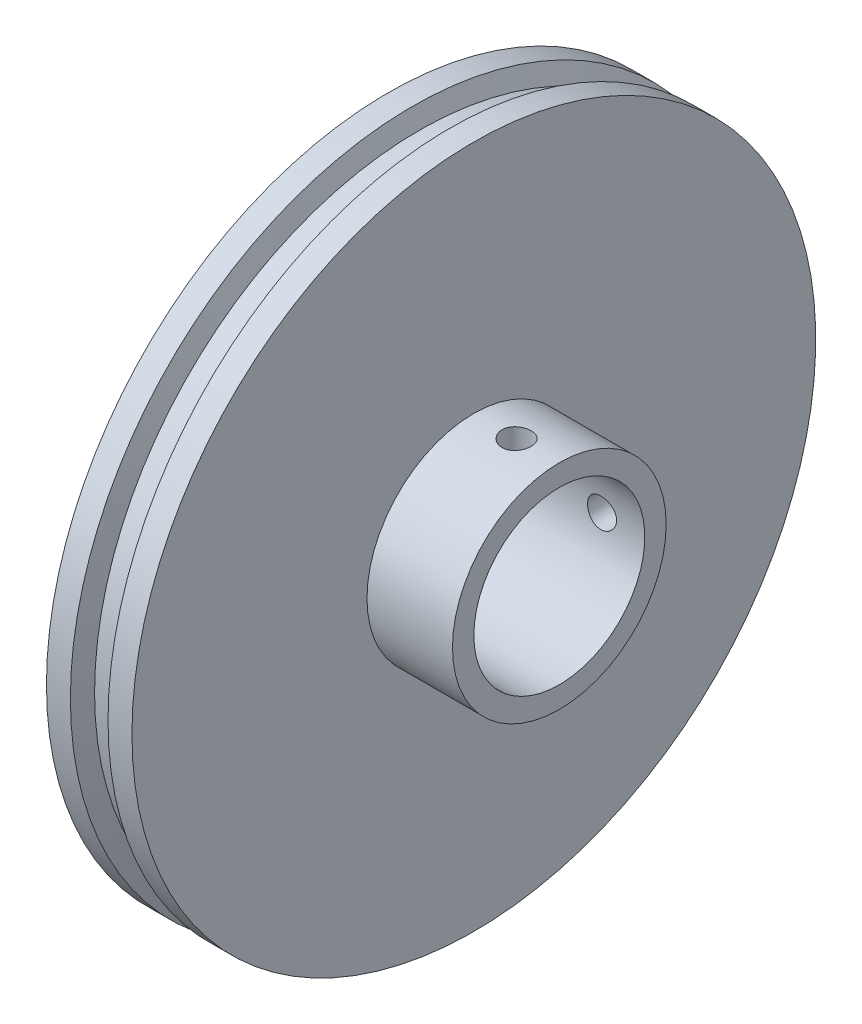
from build123d import *

# Parameters (mm, degrees)
SKETCH_7_W               = 1.7
SKETCH_7_H               = 40
PATTERN_CIRCULAR_2_COUNT = 2
PATTERN_CIRCULAR_2_ANGLE = 90


with BuildPart() as part:
    # 草图6 → 旋转2 (revolve)
    with BuildSketch(Plane.XY, mode=Mode.PRIVATE) as revolve_2_sk:
        Polygon((15, 12.5), (15, 10), (-5, 10), (-5, 40), (-2.2, 40), (-1.371572875, 38), (1.371572875, 38), (2.2, 40), (5, 40), (5, 12.5), align=None)
    revolve(revolve_2_sk.sketch.rotate(Axis((-5, 0, 0), (1, 0, 0)), 90), axis=Axis((-5, 0, 0), (1, 0, 0)))

    # 草图7 → 切除-旋转3 (revolve, cut)
    with BuildSketch(Plane.XY, mode=Mode.PRIVATE) as cut_revolve_3_sk:
        with Locations((10.85, 20)):
            Rectangle(SKETCH_7_W, SKETCH_7_H)
    cut_revolve_3 = revolve(cut_revolve_3_sk.sketch.rotate(Axis((10, 40, 0), (0, -1, 0)), 180), axis=Axis((10, 40, 0), (0, -1, 0)), mode=Mode.SUBTRACT)

    # 阵列(圆周)2: 切除-旋转3 ×2 about axis
    pattern_circular_2_axis = Axis((-5, 0, 0), (-1, 0, 0))
    for i in range(1, PATTERN_CIRCULAR_2_COUNT):
        add(cut_revolve_3.rotate(pattern_circular_2_axis, i * PATTERN_CIRCULAR_2_ANGLE / (PATTERN_CIRCULAR_2_COUNT - 1)), mode=Mode.SUBTRACT)


solid = part.part
